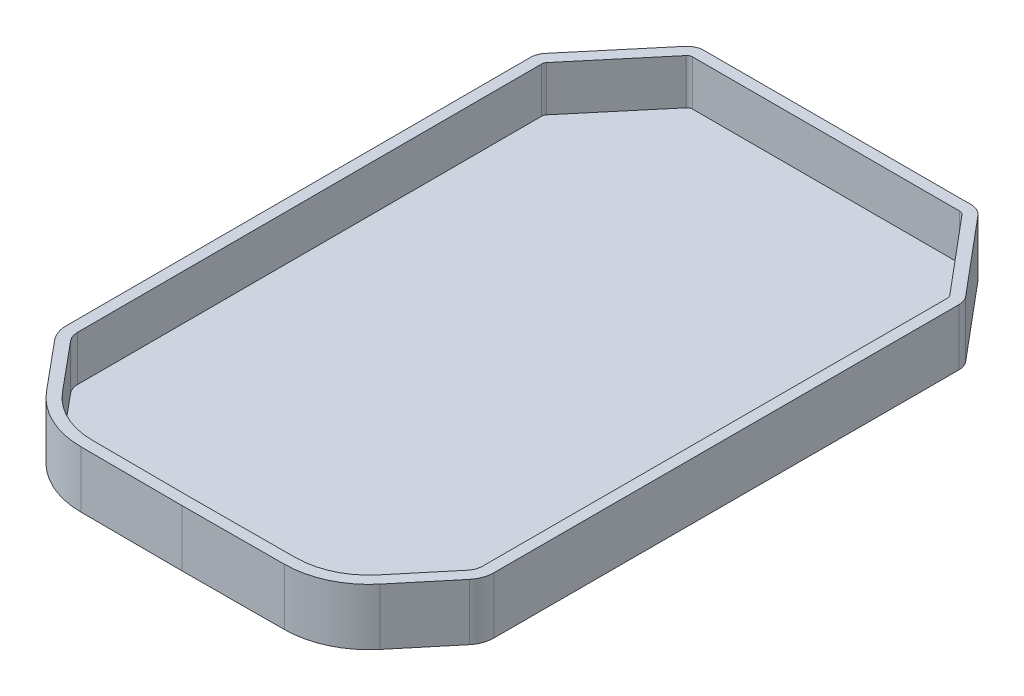
from build123d import *

# Parameters (mm, degrees)
AUFSATZ_LINEAR_AUSTRAGEN1_DEPTH = 10
VERRUNDUNG11_R                  = 15
VERRUNDUNG12_R                  = 5
VERRUNDUNG13_R                  = 3
VERRUNDUNG14_R                  = 3
WANDUNG1_T                      = -2


with BuildPart() as part:
    # Skizze1 → Aufsatz-Linear austragen1 (new body)
    with BuildSketch(Plane(origin=(0, 0, 0), x_dir=(1, 0, 0), z_dir=(0, 1, 0))):
        Polygon((0, -75.745036748), (-24.999786643, -75.641751751), (-37.792132404, -60.267881388), (-37.855752194, 24.732118612), (-25, 40.053007474), (0, 40.053007474), align=None)
    aufsatz_linear_austragen1 = extrude(amount=AUFSATZ_LINEAR_AUSTRAGEN1_DEPTH)

    # Spiegeln1: Aufsatz-Linear austragen1 across plane
    add(aufsatz_linear_austragen1.mirror(Plane(origin=(0, 0, 0), x_dir=(0, 0, 1), z_dir=(1, 0, 0))))

    # Verrundung11
    verrundung11_edges = [part.edges().sort_by_distance(p)[0] for p in [
        (-24.999786643, 5, 75.641751751),
        (24.999786643, 5, 75.641751751),
    ]]
    fillet(verrundung11_edges, radius=VERRUNDUNG11_R)

    # Verrundung12
    verrundung12_edges = [part.edges().sort_by_distance(p)[0] for p in [
        (-37.792132404, 5, 60.267881388),
        (37.792132404, 5, 60.267881388),
    ]]
    fillet(verrundung12_edges, radius=VERRUNDUNG12_R)

    # Verrundung13
    verrundung13_edges = [part.edges().sort_by_distance(p)[0] for p in [
        (-25, 5, -40.053007474),
        (25, 5, -40.053007474),
    ]]
    fillet(verrundung13_edges, radius=VERRUNDUNG13_R)

    # Verrundung14
    verrundung14_edges = [part.edges().sort_by_distance(p)[0] for p in [
        (-37.855752194, 5, -24.732118612),
        (37.855752194, 5, -24.732118612),
    ]]
    fillet(verrundung14_edges, radius=VERRUNDUNG14_R)

    # Wandung1
    wandung1_openings = [part.faces().sort_by_distance(p)[0] for p in [
        (0, 10, 17.703317915),
    ]]
    offset(amount=WANDUNG1_T, openings=wandung1_openings, kind=Kind.INTERSECTION)


solid = part.part
